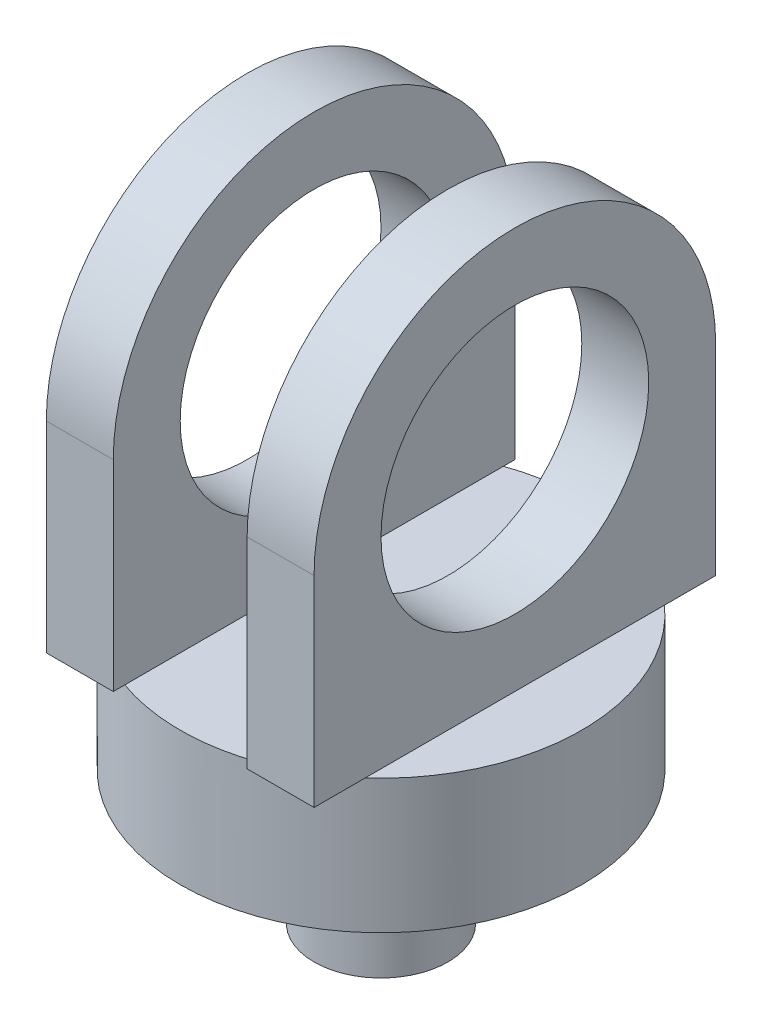
from build123d import *

# Parameters (mm, degrees)
SKETCH1_R              = 6.35
TOFITINTOBEARING_DEPTH = 12.7
SKETCH2_R              = 19.05
TOSITATOPBEARING_DEPTH = 12.7
BOSS_EXTRUDE3_START    = 6.35
BOSS_EXTRUDE3_DEPTH    = 6.35
SKETCH8_R              = 12.7
CUT_EXTRUDE3_DEPTH     = 6.35


with BuildPart() as part:
    # Sketch1 → ToFitIntoBearing (new body)
    with BuildSketch(Plane(origin=(0, 0, 0), x_dir=(1, 0, 0), z_dir=(0, 1, 0))):
        Circle(SKETCH1_R)
    extrude(amount=TOFITINTOBEARING_DEPTH)

    # Sketch2 → ToSitAtopBearing (add)
    with BuildSketch(Plane(origin=(0, 12.7, 0), x_dir=(1, 0, 0), z_dir=(0, 1, 0))):
        Circle(SKETCH2_R)
    extrude(amount=TOSITATOPBEARING_DEPTH)

    # Sketch7 → Boss-Extrude3 (add)
    with BuildSketch(Plane(origin=(0, 0, 0), x_dir=(0, 0, -1), z_dir=(1, 0, 0)).offset(BOSS_EXTRUDE3_START)):
        with BuildLine():
            Line((-19.05, 44.45), (-19.05, 25.4))
            Line((-19.05, 25.4), (19.05, 25.4))
            Line((19.05, 25.4), (19.05, 44.45))
            ThreePointArc((19.05, 44.45), (0, 63.5), (-19.05, 44.45))
        make_face()
    boss_extrude3 = extrude(amount=BOSS_EXTRUDE3_DEPTH)

    # Sketch8 → Cut-Extrude3 (cut)
    with BuildSketch(Plane.ZY.offset(-6.35)):
        with Locations((0, 44.45)):
            Circle(SKETCH8_R)
    cut_extrude3 = extrude(amount=-CUT_EXTRUDE3_DEPTH, mode=Mode.SUBTRACT)

    # Mirror2: Boss-Extrude3, Cut-Extrude3 across plane
    add(boss_extrude3.mirror(Plane(origin=(0, 0, 0), x_dir=(0, 0, 1), z_dir=(1, 0, 0))))
    add(cut_extrude3.mirror(Plane(origin=(0, 0, 0), x_dir=(0, 0, 1), z_dir=(1, 0, 0))), mode=Mode.SUBTRACT)


solid = part.part
